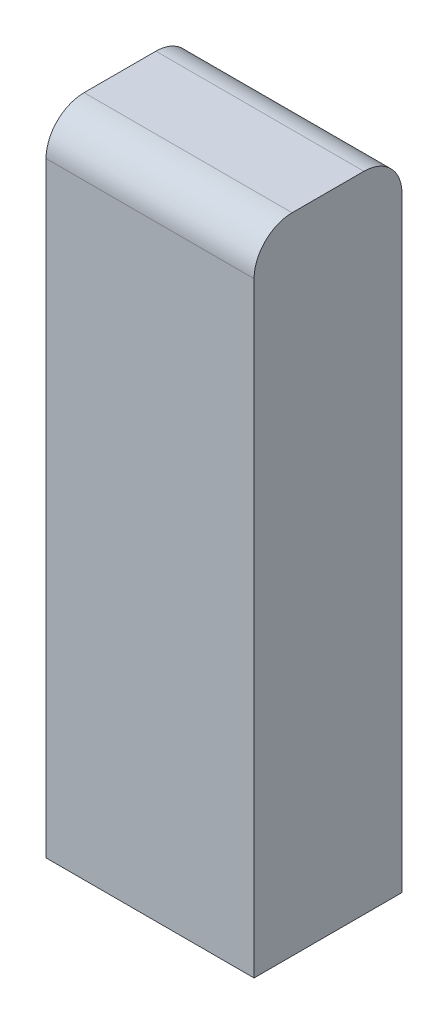
from build123d import *

# Parameters (mm, degrees)
SKETCH1_W           = 34.7218
SKETCH1_H           = 107.442
BOSS_EXTRUDE1_DEPTH = 24.6888
FILLET2_R           = 6.35


with BuildPart() as part:
    # Sketch1 → Boss-Extrude1 (new body)
    with BuildSketch(Plane.XY):
        Rectangle(SKETCH1_W, SKETCH1_H)
    extrude(amount=BOSS_EXTRUDE1_DEPTH)

    # Fillet2
    fillet2_edges = [part.edges().sort_by_distance(p)[0] for p in [
        (0, 53.721, 0),
        (0, 53.721, 24.6888),
    ]]
    fillet(fillet2_edges, radius=FILLET2_R)


solid = part.part
